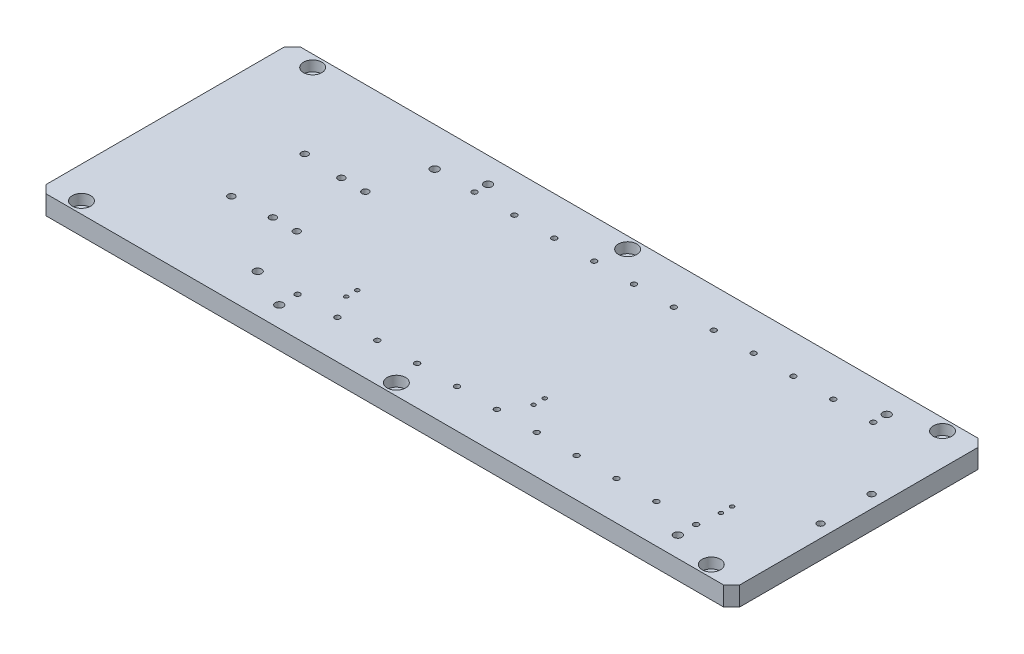
from build123d import *

# Parameters (mm, degrees)
SKETCH_1_W                   = 435
SKETCH_1_H                   = 159.5
EXTRUDE_1_DEPTH              = 12
HOLE_WIZARD_M5_2_D           = 4.2
HOLE_WIZARD_M5_2_DEPTH       = 14
HOLE_WIZARD_M5_2_TIP         = 1.2618073
HOLE_WIZARD_M4_1_AT_2_COUNT  = 2
HOLE_WIZARD_M4_1_AT_2_PITCH  = 111
PATTERN_LINEAR_1_COUNT       = 11
PATTERN_LINEAR_1_PITCH       = 25
HOLE_WIZARD_M6_1_D           = 6.5
HOLE_WIZARD_M6_1_CBORE_D     = 11.5
HOLE_WIZARD_M6_1_CBORE_DEPTH = 6.5
CHAMFER_1_SIZE               = 5
HOLE_WIZARD_M3_1_AT_2_COUNT  = 2
HOLE_WIZARD_M3_1_AT_2_PITCH  = 7
PATTERN_LINEAR_2_COUNT       = 3
PATTERN_LINEAR_2_PITCH       = 117.5
HOLE_WIZARD_5_0_5_2_D        = 5
HOLE_WIZARD_5_0_5_2_DEPTH    = 10
HOLE_WIZARD_5_0_5_2_TIP      = 1.502151548


with BuildPart() as part:
    # 草图1 → 凸台-拉伸1 (new body)
    with BuildSketch(Plane(origin=(0, 0, 0), x_dir=(1, 0, 0), z_dir=(0, 1, 0))):
        with Locations((217.5, -79.75)):
            Rectangle(SKETCH_1_W, SKETCH_1_H)
    extrude(amount=EXTRUDE_1_DEPTH)

    # M5 螺纹孔2
    with Locations(Plane(origin=(0, 12, 0), x_dir=(1, 0, 0), z_dir=(0, 1, 0))):
        with Locations((64.5, -102.75), (64.5, -56.75), (89, -58.25), (104, -58.25), (89, -101.25), (104, -101.25), (427, -63.75), (427, -95.75)):
            Hole(HOLE_WIZARD_M5_2_D / 2, depth=HOLE_WIZARD_M5_2_DEPTH)
            with Locations((0, 0, -(HOLE_WIZARD_M5_2_DEPTH + HOLE_WIZARD_M5_2_TIP / 2))):  # 118° drill point
                Cone(0, HOLE_WIZARD_M5_2_D / 2, HOLE_WIZARD_M5_2_TIP, mode=Mode.SUBTRACT)

    # 草图6 → M4 螺纹孔1 (revolve, cut)
    with BuildSketch(Plane(origin=(388.5, 12, 24.25), x_dir=(0, 0, 1), z_dir=(1, 0, 0))):
        Polygon((0, 0), (0, 12.491420021), (1.65, 11.5), (1.65, 0), align=None)
    hole_wizard_m4_1 = revolve(axis=Axis((388.5, 18.35, 24.25), (0, -1, 0)), mode=Mode.SUBTRACT)

    # M4 螺纹孔1 at 2: M4 螺纹孔1 ×2
    with Locations(*[(0, 0, i * HOLE_WIZARD_M4_1_AT_2_PITCH) for i in range(1, HOLE_WIZARD_M4_1_AT_2_COUNT)]):
        add(hole_wizard_m4_1, mode=Mode.SUBTRACT)

    # 阵列(线性)1: M4 螺纹孔1 ×11
    with Locations(*[(-i * PATTERN_LINEAR_1_PITCH, 0, 0) for i in range(1, PATTERN_LINEAR_1_COUNT)]):
        add(hole_wizard_m4_1, mode=Mode.SUBTRACT)

    # 阵列(线性)1 copy 1 sketch → 阵列(线性)1 copy 1 (revolve, cut)
    with BuildSketch(Plane(origin=(363.5, 12, 135.25), x_dir=(0, 0, 1), z_dir=(1, 0, 0))):
        Polygon((0, 0), (0, 12.491420021), (1.65, 11.5), (1.65, 0), align=None)
    revolve(axis=Axis((363.5, 18.35, 135.25), (0, -1, 0)), mode=Mode.SUBTRACT)

    # 阵列(线性)1 copy 2 sketch → 阵列(线性)1 copy 2 (revolve, cut)
    with BuildSketch(Plane(origin=(338.5, 12, 135.25), x_dir=(0, 0, 1), z_dir=(1, 0, 0))):
        Polygon((0, 0), (0, 12.491420021), (1.65, 11.5), (1.65, 0), align=None)
    revolve(axis=Axis((338.5, 18.35, 135.25), (0, -1, 0)), mode=Mode.SUBTRACT)

    # 阵列(线性)1 copy 3 sketch → 阵列(线性)1 copy 3 (revolve, cut)
    with BuildSketch(Plane(origin=(313.5, 12, 135.25), x_dir=(0, 0, 1), z_dir=(1, 0, 0))):
        Polygon((0, 0), (0, 12.491420021), (1.65, 11.5), (1.65, 0), align=None)
    revolve(axis=Axis((313.5, 18.35, 135.25), (0, -1, 0)), mode=Mode.SUBTRACT)

    # 阵列(线性)1 copy 4 sketch → 阵列(线性)1 copy 4 (revolve, cut)
    with BuildSketch(Plane(origin=(288.5, 12, 135.25), x_dir=(0, 0, 1), z_dir=(1, 0, 0))):
        Polygon((0, 0), (0, 12.491420021), (1.65, 11.5), (1.65, 0), align=None)
    revolve(axis=Axis((288.5, 18.35, 135.25), (0, -1, 0)), mode=Mode.SUBTRACT)

    # 阵列(线性)1 copy 5 sketch → 阵列(线性)1 copy 5 (revolve, cut)
    with BuildSketch(Plane(origin=(263.5, 12, 135.25), x_dir=(0, 0, 1), z_dir=(1, 0, 0))):
        Polygon((0, 0), (0, 12.491420021), (1.65, 11.5), (1.65, 0), align=None)
    revolve(axis=Axis((263.5, 18.35, 135.25), (0, -1, 0)), mode=Mode.SUBTRACT)

    # 阵列(线性)1 copy 6 sketch → 阵列(线性)1 copy 6 (revolve, cut)
    with BuildSketch(Plane(origin=(238.5, 12, 135.25), x_dir=(0, 0, 1), z_dir=(1, 0, 0))):
        Polygon((0, 0), (0, 12.491420021), (1.65, 11.5), (1.65, 0), align=None)
    revolve(axis=Axis((238.5, 18.35, 135.25), (0, -1, 0)), mode=Mode.SUBTRACT)

    # 阵列(线性)1 copy 7 sketch → 阵列(线性)1 copy 7 (revolve, cut)
    with BuildSketch(Plane(origin=(213.5, 12, 135.25), x_dir=(0, 0, 1), z_dir=(1, 0, 0))):
        Polygon((0, 0), (0, 12.491420021), (1.65, 11.5), (1.65, 0), align=None)
    revolve(axis=Axis((213.5, 18.35, 135.25), (0, -1, 0)), mode=Mode.SUBTRACT)

    # 阵列(线性)1 copy 8 sketch → 阵列(线性)1 copy 8 (revolve, cut)
    with BuildSketch(Plane(origin=(188.5, 12, 135.25), x_dir=(0, 0, 1), z_dir=(1, 0, 0))):
        Polygon((0, 0), (0, 12.491420021), (1.65, 11.5), (1.65, 0), align=None)
    revolve(axis=Axis((188.5, 18.35, 135.25), (0, -1, 0)), mode=Mode.SUBTRACT)

    # 阵列(线性)1 copy 9 sketch → 阵列(线性)1 copy 9 (revolve, cut)
    with BuildSketch(Plane(origin=(163.5, 12, 135.25), x_dir=(0, 0, 1), z_dir=(1, 0, 0))):
        Polygon((0, 0), (0, 12.491420021), (1.65, 11.5), (1.65, 0), align=None)
    revolve(axis=Axis((163.5, 18.35, 135.25), (0, -1, 0)), mode=Mode.SUBTRACT)

    # 阵列(线性)1 copy 10 sketch → 阵列(线性)1 copy 10 (revolve, cut)
    with BuildSketch(Plane(origin=(138.5, 12, 135.25), x_dir=(0, 0, 1), z_dir=(1, 0, 0))):
        Polygon((0, 0), (0, 12.491420021), (1.65, 11.5), (1.65, 0), align=None)
    revolve(axis=Axis((138.5, 18.35, 135.25), (0, -1, 0)), mode=Mode.SUBTRACT)

    # M6 六角头螺栓的柱形沉头孔1 (through all)
    with Locations(Plane(origin=(0, 12, 0), x_dir=(1, 0, 0), z_dir=(0, 1, 0))):
        with Locations((20, -7.25), (217.5, -7.25), (415, -7.25), (20, -152.25), (217.5, -152.25), (415, -152.25)):
            CounterBoreHole(HOLE_WIZARD_M6_1_D / 2, HOLE_WIZARD_M6_1_CBORE_D / 2, HOLE_WIZARD_M6_1_CBORE_DEPTH)

    # 倒角1
    chamfer_1_edges = [part.edges().sort_by_distance(p)[0] for p in [
        (435, 6, 159.5),
        (435, 6, 0),
        (0, 6, 0),
        (0, 6, 159.5),
    ]]
    chamfer(chamfer_1_edges, length=CHAMFER_1_SIZE)

    # 草图10 → M3 螺纹孔1 (revolve, cut)
    with BuildSketch(Plane(origin=(155, 12, 121.25), x_dir=(0, 0, 1), z_dir=(1, 0, 0))):
        Polygon((0, 0), (0, 9.251075774), (1.25, 8.5), (1.25, 0), align=None)
    hole_wizard_m3_1 = revolve(axis=Axis((155, 18.35, 121.25), (0, -1, 0)), mode=Mode.SUBTRACT)

    # M3 螺纹孔1 at 2: M3 螺纹孔1 ×2
    with Locations(*[(0, 0, -i * HOLE_WIZARD_M3_1_AT_2_PITCH) for i in range(1, HOLE_WIZARD_M3_1_AT_2_COUNT)]):
        add(hole_wizard_m3_1, mode=Mode.SUBTRACT)

    # 阵列(线性)2: M3 螺纹孔1 ×3
    with Locations(*[(i * PATTERN_LINEAR_2_PITCH, 0, 0) for i in range(1, PATTERN_LINEAR_2_COUNT)]):
        add(hole_wizard_m3_1, mode=Mode.SUBTRACT)

    # 阵列(线性)2 copy 1 sketch → 阵列(线性)2 copy 1 (revolve, cut)
    with BuildSketch(Plane(origin=(272.5, 12, 114.25), x_dir=(0, 0, 1), z_dir=(1, 0, 0))):
        Polygon((0, 0), (0, 9.251075774), (1.25, 8.5), (1.25, 0), align=None)
    revolve(axis=Axis((272.5, 18.35, 114.25), (0, -1, 0)), mode=Mode.SUBTRACT)

    # 阵列(线性)2 copy 2 sketch → 阵列(线性)2 copy 2 (revolve, cut)
    with BuildSketch(Plane(origin=(390, 12, 114.25), x_dir=(0, 0, 1), z_dir=(1, 0, 0))):
        Polygon((0, 0), (0, 9.251075774), (1.25, 8.5), (1.25, 0), align=None)
    revolve(axis=Axis((390, 18.35, 114.25), (0, -1, 0)), mode=Mode.SUBTRACT)

    # Ø5.0 (5) 直径孔2
    with Locations(Plane(origin=(0, 12, 0), x_dir=(1, 0, 0), z_dir=(0, 1, 0))):
        with Locations((113.5, -135.25), (138.5, -146.75), (388.5, -146.75), (388.5, -15.75), (113.5, -24.25), (138.5, -15.75)):
            Hole(HOLE_WIZARD_5_0_5_2_D / 2, depth=HOLE_WIZARD_5_0_5_2_DEPTH)
            with Locations((0, 0, -(HOLE_WIZARD_5_0_5_2_DEPTH + HOLE_WIZARD_5_0_5_2_TIP / 2))):  # 118° drill point
                Cone(0, HOLE_WIZARD_5_0_5_2_D / 2, HOLE_WIZARD_5_0_5_2_TIP, mode=Mode.SUBTRACT)


solid = part.part
